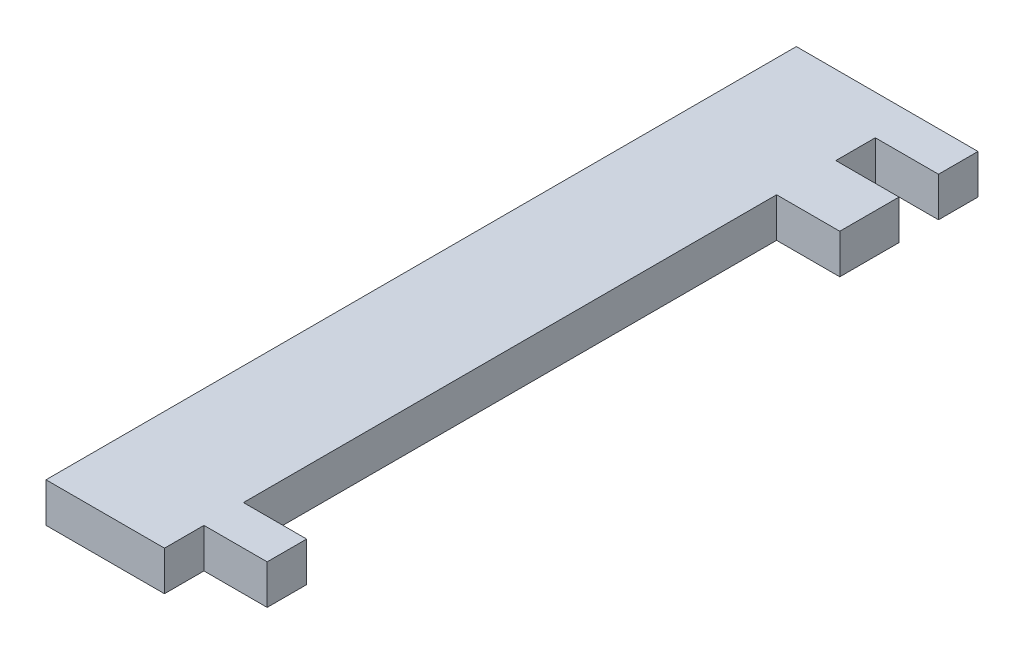
from build123d import *

# Parameters (mm, degrees)
CROQUIS1_W              = 15
CROQUIS1_H              = 5
SALIENTE_EXTRUIR1_DEPTH = 90
SALIENTE_EXTRUIR2_DEPTH = 5
CROQUIS3_W              = 23
CROQUIS3_H              = 7.5
CROQUIS3_H_2            = 5
SALIENTE_EXTRUIR3_DEPTH = 5


with BuildPart() as part:
    # Croquis1 → Saliente-Extruir1 (new body)
    with BuildSketch(Plane.XY):
        Rectangle(CROQUIS1_W, CROQUIS1_H)
    extrude(amount=SALIENTE_EXTRUIR1_DEPTH)

    # Croquis2 → Saliente-Extruir2 (add)
    with BuildSketch(Plane(origin=(0, 0, 0), x_dir=(-1, 0, 0), z_dir=(0, 0, -1))):
        Polygon((-7.5, 2.5), (-15.5, 2.5), (-15.5, -2.5), (-7.5, -2.5), (7.5, -2.5), (7.5, 2.5), align=None)
    extrude(amount=SALIENTE_EXTRUIR2_DEPTH)

    # Croquis3 → Saliente-Extruir3 (add)
    with BuildSketch(Plane(origin=(0, 2.5, 0), x_dir=(1, 0, 0), z_dir=(0, 1, 0))):
        with Locations((4, -8.75)):
            Rectangle(CROQUIS3_W, CROQUIS3_H)
        with Locations((4, -82.5)):
            Rectangle(CROQUIS3_W, CROQUIS3_H_2)
    extrude(amount=-SALIENTE_EXTRUIR3_DEPTH)


solid = part.part
